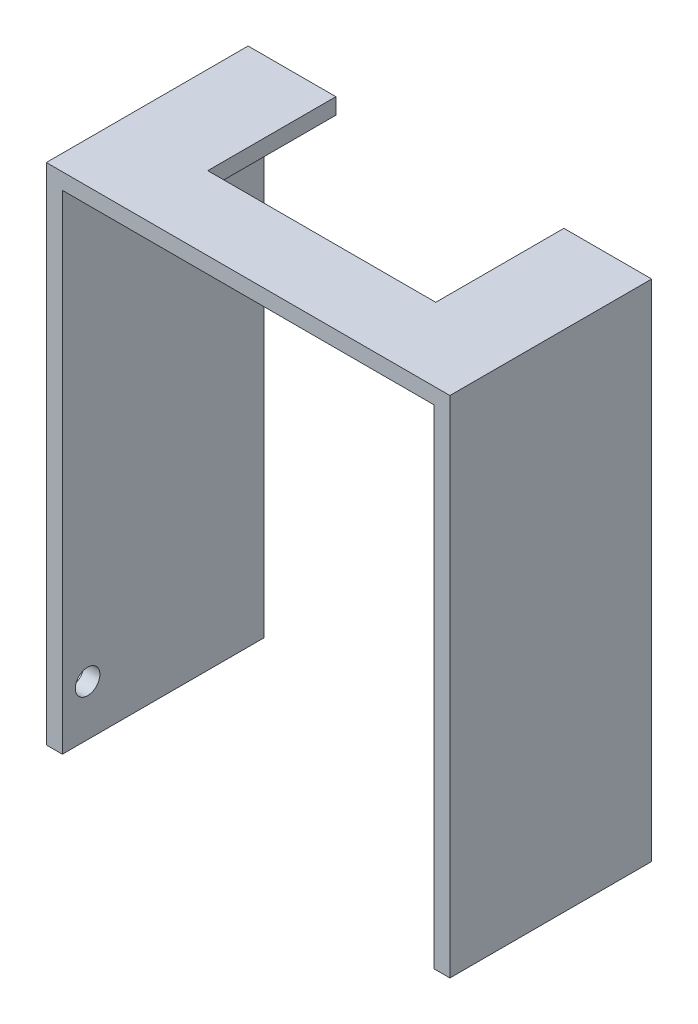
from build123d import *

# Parameters (mm, degrees)
BOSS_EXTRUDE1_DEPTH        = 20
SKETCH2_W                  = 22.6
SKETCH2_H                  = 12.7
CUT_EXTRUDE1_DEPTH         = 10
F_2_CLEARANCE_HOLE1_REACH  = 69.082
F_2_CLEARANCE_HOLE1_BORE_R = 1.2192


with BuildPart() as part:
    # Sketch1 → Boss-Extrude1 (new body)
    with BuildSketch(Plane.XY):
        Polygon((1.59, -50), (1.59, -1.59), (38.41, -1.59), (38.41, -50), (40, -50), (40, 0), (0, 0), (0, -50), align=None)
    extrude(amount=BOSS_EXTRUDE1_DEPTH)

    # Sketch2 → Cut-Extrude1 (cut)
    with BuildSketch(Plane(origin=(0, 0, 0), x_dir=(1, 0, 0), z_dir=(0, 1, 0))):
        with Locations((20, -6.35)):
            Rectangle(SKETCH2_W, SKETCH2_H)
    extrude(amount=-CUT_EXTRUDE1_DEPTH, mode=Mode.SUBTRACT)

    # #2 Clearance Hole1 bore → #2 Clearance Hole1 (cut, up to next)
    with BuildSketch(Plane.ZY, mode=Mode.PRIVATE) as f_2_clearance_hole1_sk1:
        with Locations((2.5, -5)):
            Circle(F_2_CLEARANCE_HOLE1_BORE_R)
    f_2_clearance_hole1_tool1 = extrude(f_2_clearance_hole1_sk1.sketch, amount=-F_2_CLEARANCE_HOLE1_REACH, mode=Mode.PRIVATE) & part.part
    # #2 Clearance Hole1 bore → #2 Clearance Hole1 (cut, up to next)
    with BuildSketch(Plane.ZY, mode=Mode.PRIVATE) as f_2_clearance_hole1_sk2:
        with Locations((17.5, -45)):
            Circle(F_2_CLEARANCE_HOLE1_BORE_R)
    f_2_clearance_hole1_tool2 = extrude(f_2_clearance_hole1_sk2.sketch, amount=-F_2_CLEARANCE_HOLE1_REACH, mode=Mode.PRIVATE) & part.part
    add(f_2_clearance_hole1_tool1.solids().sort_by_distance((0, -5, 2.5))[0], mode=Mode.SUBTRACT)
    add(f_2_clearance_hole1_tool2.solids().sort_by_distance((0, -45, 17.5))[0], mode=Mode.SUBTRACT)


solid = part.part
